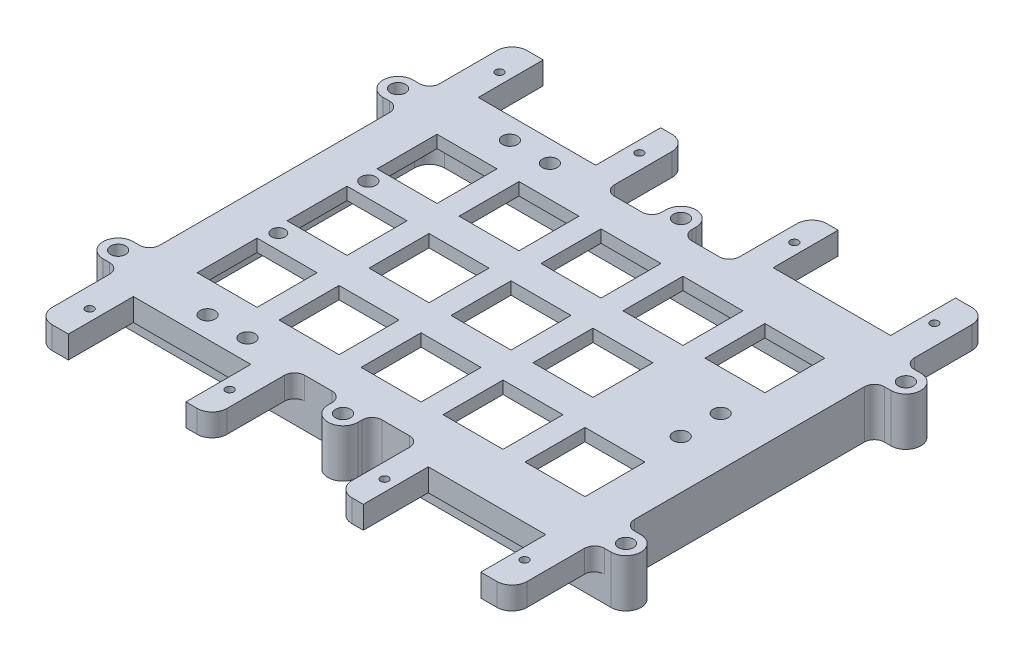
from build123d import *

# Parameters (mm, degrees)
SKETCH_1_R          = 1.5
SKETCH_1_R_2        = 0.8
EXTRUDE_1_DEPTH     = 9.6
CUT_EXTRUDE_START   = -5.1
CUT_EXTRUDE_1_DEPTH = 5.1
SKETCH_3_W          = 90
SKETCH_3_H          = 57
CUT_EXTRUDE_2_DEPTH = 7.1
FILLET_1_R          = 3
FILLET_2_R          = 1
SKETCH_13_W         = 12
SKETCH_13_H         = 12
CUT_EXTRUDE_3_DEPTH = 73.118652234
SKETCH_14_R         = 1.334049313
SKETCH_14_R_2       = 1.5
EXTRUDE_4_DEPTH     = 3
CUT_EXTRUDE_START_2 = -4.5
SKETCH_16_R         = 1.5
SKETCH_16_R_2       = 1.334049313
CUT_EXTRUDE_4_DEPTH = 4.5
SKETCH_17_W         = 127.095942594
SKETCH_17_H         = 103.340493134
CUT_EXTRUDE_5_DEPTH = 73.407527233


with BuildPart() as part:
    # 草图1 → 凸台-拉伸1 (new body)
    with BuildSketch(Plane(origin=(0, 0, 0), x_dir=(1, 0, 0), z_dir=(0, 1, 0))):
        with BuildLine():
            Line((-47.5, 23), (-47.5, -23))
            ThreePointArc((-47.5, -23), (-48.085786438, -24.414213562), (-49.5, -25))
            Line((-49.5, -25), (-50.8, -25))
            ThreePointArc((-50.8, -25), (-53.8, -28), (-50.8, -31))
            Line((-50.8, -31), (-49.5, -31))
            ThreePointArc((-49.5, -31), (-48.085786438, -31.585786438), (-47.5, -33))
            Line((-47.5, -33), (-47.5, -44.5))
            ThreePointArc((-47.5, -44.5), (-46.621320344, -46.621320344), (-44.5, -47.5))
            Line((-44.5, -47.5), (-41.25, -47.5))
            Line((-41.25, -47.5), (-41.25, -34.5))
            Line((-41.25, -34.5), (-17.75, -34.5))
            Line((-17.75, -34.5), (-17.75, -47.5))
            Line((-17.75, -47.5), (-15.5, -47.5))
            ThreePointArc((-15.5, -47.5), (-13.378679656, -46.621320344), (-12.5, -44.5))
            Line((-12.5, -44.5), (-12.5, -33))
            ThreePointArc((-12.5, -33), (-11.914213562, -31.585786438), (-10.5, -31))
            Line((-10.5, -31), (-5, -31))
            ThreePointArc((-5, -31), (-3.585786438, -31.585786438), (-3, -33))
            Line((-3, -33), (-3, -33.8))
            ThreePointArc((-3, -33.8), (0, -36.8), (3, -33.8))
            Line((3, -33.8), (3, -33))
            ThreePointArc((3, -33), (3.585786438, -31.585786438), (5, -31))
            Line((5, -31), (10.5, -31))
            ThreePointArc((10.5, -31), (11.914213562, -31.585786438), (12.5, -33))
            Line((12.5, -33), (12.5, -44.5))
            ThreePointArc((12.5, -44.5), (13.378679656, -46.621320344), (15.5, -47.5))
            Line((15.5, -47.5), (17.75, -47.5))
            Line((17.75, -47.5), (17.75, -34.5))
            Line((17.75, -34.5), (41.25, -34.5))
            Line((41.25, -34.5), (41.25, -47.5))
            Line((41.25, -47.5), (44.5, -47.5))
            ThreePointArc((44.5, -47.5), (46.621320344, -46.621320344), (47.5, -44.5))
            Line((47.5, -44.5), (47.5, -33))
            ThreePointArc((47.5, -33), (48.085786438, -31.585786438), (49.5, -31))
            Line((49.5, -31), (50.8, -31))
            ThreePointArc((50.8, -31), (53.8, -28), (50.8, -25))
            Line((50.8, -25), (49.5, -25))
            ThreePointArc((49.5, -25), (48.085786438, -24.414213562), (47.5, -23))
            Line((47.5, -23), (47.5, 23))
            ThreePointArc((47.5, 23), (48.085786438, 24.414213562), (49.5, 25))
            Line((49.5, 25), (50.8, 25))
            ThreePointArc((50.8, 25), (53.8, 28), (50.8, 31))
            Line((50.8, 31), (49.5, 31))
            ThreePointArc((49.5, 31), (48.085786438, 31.585786438), (47.5, 33))
            Line((47.5, 33), (47.5, 44.5))
            ThreePointArc((47.5, 44.5), (46.621320344, 46.621320344), (44.5, 47.5))
            Line((44.5, 47.5), (41.25, 47.5))
            Line((41.25, 47.5), (41.25, 34.5))
            Line((41.25, 34.5), (17.75, 34.5))
            Line((17.75, 34.5), (17.75, 47.5))
            Line((17.75, 47.5), (15.5, 47.5))
            ThreePointArc((15.5, 47.5), (13.378679656, 46.621320344), (12.5, 44.5))
            Line((12.5, 44.5), (12.5, 33))
            ThreePointArc((12.5, 33), (11.914213562, 31.585786438), (10.5, 31))
            Line((10.5, 31), (5, 31))
            ThreePointArc((5, 31), (3.585786438, 31.585786438), (3, 33))
            Line((3, 33), (3, 33.8))
            ThreePointArc((3, 33.8), (0, 36.8), (-3, 33.8))
            Line((-3, 33.8), (-3, 33))
            ThreePointArc((-3, 33), (-3.585786438, 31.585786438), (-5, 31))
            Line((-5, 31), (-10.5, 31))
            ThreePointArc((-10.5, 31), (-11.914213562, 31.585786438), (-12.5, 33))
            Line((-12.5, 33), (-12.5, 44.5))
            ThreePointArc((-12.5, 44.5), (-13.378679656, 46.621320344), (-15.5, 47.5))
            Line((-15.5, 47.5), (-17.75, 47.5))
            Line((-17.75, 47.5), (-17.75, 34.5))
            Line((-17.75, 34.5), (-41.25, 34.5))
            Line((-41.25, 34.5), (-41.25, 47.5))
            Line((-41.25, 47.5), (-44.5, 47.5))
            ThreePointArc((-44.5, 47.5), (-46.621320344, 46.621320344), (-47.5, 44.5))
            Line((-47.5, 44.5), (-47.5, 33))
            ThreePointArc((-47.5, 33), (-48.085786438, 31.585786438), (-49.5, 31))
            Line((-49.5, 31), (-50.8, 31))
            ThreePointArc((-50.8, 31), (-53.8, 28), (-50.8, 25))
            Line((-50.8, 25), (-49.5, 25))
            ThreePointArc((-49.5, 25), (-48.085786438, 24.414213562), (-47.5, 23))
        make_face()
        with Locations(Location((-50.8, 28, 0), (0, 0, 270))):
            Circle(SKETCH_1_R, mode=Mode.SUBTRACT)
        with Locations(Location((50.8, 28, 0), (0, 0, 90))):
            Circle(SKETCH_1_R, mode=Mode.SUBTRACT)
        with Locations(Location((50.8, -28, 0), (0, 0, 270))):
            Circle(SKETCH_1_R, mode=Mode.SUBTRACT)
        with Locations(Location((-50.8, -28, 0), (0, 0, 90))):
            Circle(SKETCH_1_R, mode=Mode.SUBTRACT)
        with Locations(Location((0, 33.8, 0), (0, 0, 270))):
            Circle(SKETCH_1_R, mode=Mode.SUBTRACT)
        with Locations(Location((0, -33.8, 0), (0, 0, 90))):
            Circle(SKETCH_1_R, mode=Mode.SUBTRACT)
        with Locations(Location((43.5, 41, 0), (0, 0, 270))):
            Circle(SKETCH_1_R_2, mode=Mode.SUBTRACT)
        with Locations(Location((15.5, 41, 0), (0, 0, 90))):
            Circle(SKETCH_1_R_2, mode=Mode.SUBTRACT)
        with Locations(Location((43.5, -41, 0), (0, 0, 90))):
            Circle(SKETCH_1_R_2, mode=Mode.SUBTRACT)
        with Locations(Location((15.5, -41, 0), (0, 0, 270))):
            Circle(SKETCH_1_R_2, mode=Mode.SUBTRACT)
        with Locations(Location((-15.5, -41, 0), (0, 0, 90))):
            Circle(SKETCH_1_R_2, mode=Mode.SUBTRACT)
        with Locations(Location((-43.5, -41, 0), (0, 0, 270))):
            Circle(SKETCH_1_R_2, mode=Mode.SUBTRACT)
        with Locations(Location((-43.5, 41, 0), (0, 0, 90))):
            Circle(SKETCH_1_R_2, mode=Mode.SUBTRACT)
        with Locations(Location((-15.5, 41, 0), (0, 0, 270))):
            Circle(SKETCH_1_R_2, mode=Mode.SUBTRACT)
    extrude(amount=-EXTRUDE_1_DEPTH)

    # 草图2 → 切除-拉伸1 (cut)
    with BuildSketch(Plane.XZ.offset(9.6).offset(CUT_EXTRUDE_START)):
        with BuildLine():
            Line((63.557901373, 31), (5, 31))
            ThreePointArc((5, 31), (3.585786438, 31.585786438), (3, 33))
            Line((3, 33), (3, 33.8))
            ThreePointArc((3, 33.8), (0, 36.8), (-3, 33.8))
            Line((-3, 33.8), (-3, 33))
            ThreePointArc((-3, 33), (-3.585786438, 31.585786438), (-5, 31))
            Line((-5, 31), (-73.010332056, 31))
            Line((-73.010332056, 31), (-73.010332056, 53.694218021))
            Line((-73.010332056, 53.694218021), (63.557901373, 53.694218021))
            Line((63.557901373, 53.694218021), (63.557901373, 31))
        make_face()
        with BuildLine():
            Line((63.557901373, -31), (63.557901373, -53.694218021))
            Line((63.557901373, -53.694218021), (-73.010332056, -53.694218021))
            Line((-73.010332056, -53.694218021), (-73.010332056, -31))
            Line((-73.010332056, -31), (-5, -31))
            ThreePointArc((-5, -31), (-3.585786438, -31.585786438), (-3, -33))
            Line((-3, -33), (-3, -33.8))
            ThreePointArc((-3, -33.8), (0, -36.8), (3, -33.8))
            Line((3, -33.8), (3, -33))
            ThreePointArc((3, -33), (3.585786438, -31.585786438), (5, -31))
            Line((5, -31), (63.557901373, -31))
        make_face()
    extrude(amount=CUT_EXTRUDE_1_DEPTH, mode=Mode.SUBTRACT)

    # 草图3 → 切除-拉伸2 (cut)
    with BuildSketch(Plane.XZ.offset(9.6)):
        Rectangle(SKETCH_3_W, SKETCH_3_H)
    extrude(amount=-CUT_EXTRUDE_2_DEPTH, mode=Mode.SUBTRACT)

    # 圆角1
    fillet_1_edges = [part.edges().sort_by_distance(p)[0] for p in [
        (45, -6.05, 28.5),
        (45, -6.05, -28.5),
        (-45, -6.05, -28.5),
        (-45, -6.05, 28.5),
    ]]
    fillet(fillet_1_edges, radius=FILLET_1_R)

    # 圆角2
    fillet_2_edges = [part.edges().sort_by_distance(p)[0] for p in [
        (0, -2.5, -28.5),
        (-45, -2.5, 0),
        (45, -2.5, 0),
        (0, -2.5, 28.5),
        (44.121320344, -2.5, 27.621320344),
        (44.121320344, -2.5, -27.621320344),
        (-44.121320344, -2.5, 27.621320344),
        (-44.121320344, -2.5, -27.621320344),
    ]]
    fillet(fillet_2_edges, radius=FILLET_2_R)

    # 草图13 → 切除-拉伸3 (cut, through all)
    with BuildSketch(Plane.XZ.offset(2.5)):
        with Locations((-33, 18)):
            Rectangle(SKETCH_13_W, SKETCH_13_H)
        with Locations((-16.6, 18)):
            Rectangle(SKETCH_13_W, SKETCH_13_H)
        with Locations((-0.2, 18)):
            Rectangle(SKETCH_13_W, SKETCH_13_H)
        with Locations((16.2, 18)):
            Rectangle(SKETCH_13_W, SKETCH_13_H)
        with Locations((32.6, 18)):
            Rectangle(SKETCH_13_W, SKETCH_13_H)
        with Locations((-16.6, 0)):
            Rectangle(SKETCH_13_W, SKETCH_13_H)
        with Locations((-0.2, 0)):
            Rectangle(SKETCH_13_W, SKETCH_13_H)
        with Locations((16.2, 0)):
            Rectangle(SKETCH_13_W, SKETCH_13_H)
        with Locations((-16.6, -18)):
            Rectangle(SKETCH_13_W, SKETCH_13_H)
        with Locations((-0.2, -18)):
            Rectangle(SKETCH_13_W, SKETCH_13_H)
        with Locations((16.2, -18)):
            Rectangle(SKETCH_13_W, SKETCH_13_H)
        with Locations((32.6, -18)):
            Rectangle(SKETCH_13_W, SKETCH_13_H)
        with Locations((-33, 0)):
            Rectangle(SKETCH_13_W, SKETCH_13_H)
        with Locations((-33, -18)):
            Rectangle(SKETCH_13_W, SKETCH_13_H)
    extrude(amount=-CUT_EXTRUDE_3_DEPTH, mode=Mode.SUBTRACT)

    # 草图14 → 凸台-拉伸4 (add)
    # profile 1 of 4: a face of its own
    with BuildSketch(Plane(origin=(0, 0, 0), x_dir=(1, 0, 0), z_dir=(0, 1, 0))):
        with BuildLine():
            Line((-40.75, 9), (-40.75, -9))
            ThreePointArc((-40.75, -9), (-37.75, -12), (-34.75, -9))
            Line((-34.75, -9), (-34.75, 9))
            ThreePointArc((-34.75, 9), (-37.75, 12), (-40.75, 9))
        make_face()
        with Locations(Location((-37.75, -9, 0), (0, 0, 270))):
            Circle(SKETCH_14_R, mode=Mode.SUBTRACT)
        with Locations(Location((-37.75, 9, 0), (0, 0, 270))):
            Circle(SKETCH_14_R_2, mode=Mode.SUBTRACT)
    # profile 2 of 4: a face of its own
    with BuildSketch(Plane(origin=(0, 0, 0), x_dir=(1, 0, 0), z_dir=(0, 1, 0))):
        with BuildLine():
            Line((40.75, -4), (40.75, 4))
            ThreePointArc((40.75, 4), (37.75, 7), (34.75, 4))
            Line((34.75, 4), (34.75, -4))
            ThreePointArc((34.75, -4), (37.75, -7), (40.75, -4))
        make_face()
        with Locations(Location((37.75, -4, 0), (0, 0, 270))):
            Circle(SKETCH_14_R_2, mode=Mode.SUBTRACT)
        with Locations(Location((37.75, 4, 0), (0, 0, 270))):
            Circle(SKETCH_14_R_2, mode=Mode.SUBTRACT)
    # profile 3 of 4: a face of its own
    with BuildSketch(Plane(origin=(0, 0, 0), x_dir=(1, 0, 0), z_dir=(0, 1, 0))):
        with BuildLine():
            Line((-30.668230288, 27.25), (-22.668230288, 27.25))
            ThreePointArc((-22.668230288, 27.25), (-19.668230288, 30.25), (-22.668230288, 33.25))
            Line((-22.668230288, 33.25), (-30.668230288, 33.25))
            ThreePointArc((-30.668230288, 33.25), (-33.668230288, 30.25), (-30.668230288, 27.25))
        make_face()
        with Locations(Location((-22.668230288, 30.25, 0), (0, 0, 270))):
            Circle(SKETCH_14_R_2, mode=Mode.SUBTRACT)
        with Locations(Location((-30.668230288, 30.25, 0), (0, 0, 270))):
            Circle(SKETCH_14_R_2, mode=Mode.SUBTRACT)
    # profile 4 of 4: a face of its own
    with BuildSketch(Plane(origin=(0, 0, 0), x_dir=(1, 0, 0), z_dir=(0, 1, 0))):
        with BuildLine():
            ThreePointArc((-22.668230288, -27.25), (-19.668230288, -30.25), (-22.668230288, -33.25))
            Line((-22.668230288, -33.25), (-30.668230288, -33.25))
            ThreePointArc((-30.668230288, -33.25), (-33.668230288, -30.25), (-30.668230288, -27.25))
            Line((-30.668230288, -27.25), (-22.668230288, -27.25))
        make_face()
        with Locations(Location((-30.668230288, -30.25, 0), (0, 0, 270))):
            Circle(SKETCH_14_R_2, mode=Mode.SUBTRACT)
        with Locations(Location((-22.668230288, -30.25, 0), (0, 0, 270))):
            Circle(SKETCH_14_R_2, mode=Mode.SUBTRACT)
    extrude(amount=EXTRUDE_4_DEPTH)

    # 草图16 → 切除-拉伸4 (cut)
    with BuildSketch(Plane(origin=(0, 0, 0), x_dir=(1, 0, 0), z_dir=(0, 1, 0)).offset(CUT_EXTRUDE_START_2)):
        with Locations(Location((37.75, 4, 0), (0, 0, 270))):
            Circle(SKETCH_16_R)
        with Locations(Location((37.75, -4, 0), (0, 0, 270))):
            Circle(SKETCH_16_R)
        with Locations(Location((-22.668230288, -30.25, 0), (0, 0, 210))):
            Circle(SKETCH_16_R)
        with Locations(Location((-30.668230288, -30.25, 0), (0, 0, 210))):
            Circle(SKETCH_16_R)
        with Locations(Location((-37.75, -9, 0), (0, 0, 270))):
            Circle(SKETCH_16_R_2)
        with Locations(Location((-37.75, 9, 0), (0, 0, 270))):
            Circle(SKETCH_16_R)
        with Locations(Location((-22.668230288, 30.25, 0), (0, 0, 30))):
            Circle(SKETCH_16_R)
        with Locations(Location((-30.668230288, 30.25, 0), (0, 0, 30))):
            Circle(SKETCH_16_R)
    extrude(amount=CUT_EXTRUDE_4_DEPTH, mode=Mode.SUBTRACT)

    # 草图17 → 切除-拉伸5 (cut, through all)
    with BuildSketch(Plane(origin=(0, 0, 0), x_dir=(1, 0, 0), z_dir=(0, 1, 0))):
        Rectangle(SKETCH_17_W, SKETCH_17_H)
    extrude(amount=CUT_EXTRUDE_5_DEPTH, mode=Mode.SUBTRACT)


solid = part.part
